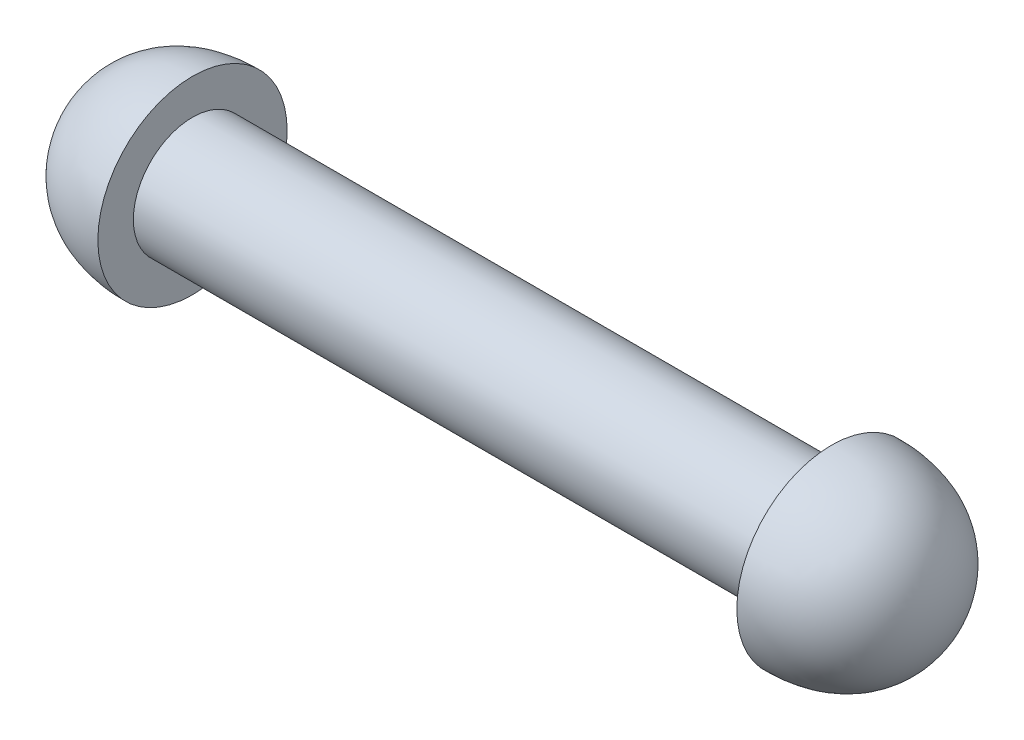
from build123d import *

# Parameters (mm, degrees)
SKETCH1_R           = 25
BOSS_EXTRUDE1_DEPTH = 135


with BuildPart() as part:
    # Sketch1 → Boss-Extrude1 (new body)
    with BuildSketch(Plane(origin=(0, 0, 0), x_dir=(0, 0, -1), z_dir=(1, 0, 0))):
        Circle(SKETCH1_R)
    boss_extrude1 = extrude(amount=BOSS_EXTRUDE1_DEPTH)

    # Sketch3 → Revolve1 (revolve)
    with BuildSketch(Plane.XY, mode=Mode.PRIVATE) as revolve1_sk:
        with BuildLine():
            Line((0, 0), (-45.458392513, 0))
            add(Edge.make_bspline(
                [(-45.458392513, 0), (-45.458392513, 20.183781855), (-30.991238831, 40), (0, 40)],
                knots=[0, 0, 0, 0, 1, 1, 1, 1], degree=3))
            Line((0, 40), (0, 0))
        make_face()
    revolve1 = revolve(revolve1_sk.sketch.rotate(Axis((-100.078673334, 0, 0), (1, 0, 0)), 90), axis=Axis((-100.078673334, 0, 0), (1, 0, 0)))

    # Mirror1: Boss-Extrude1, Revolve1 across plane
    add(boss_extrude1.mirror(Plane(origin=(135, 0, 0), x_dir=(0, 0, 1), z_dir=(1, 0, 0))))
    add(revolve1.mirror(Plane(origin=(135, 0, 0), x_dir=(0, 0, 1), z_dir=(1, 0, 0))))


solid = part.part
